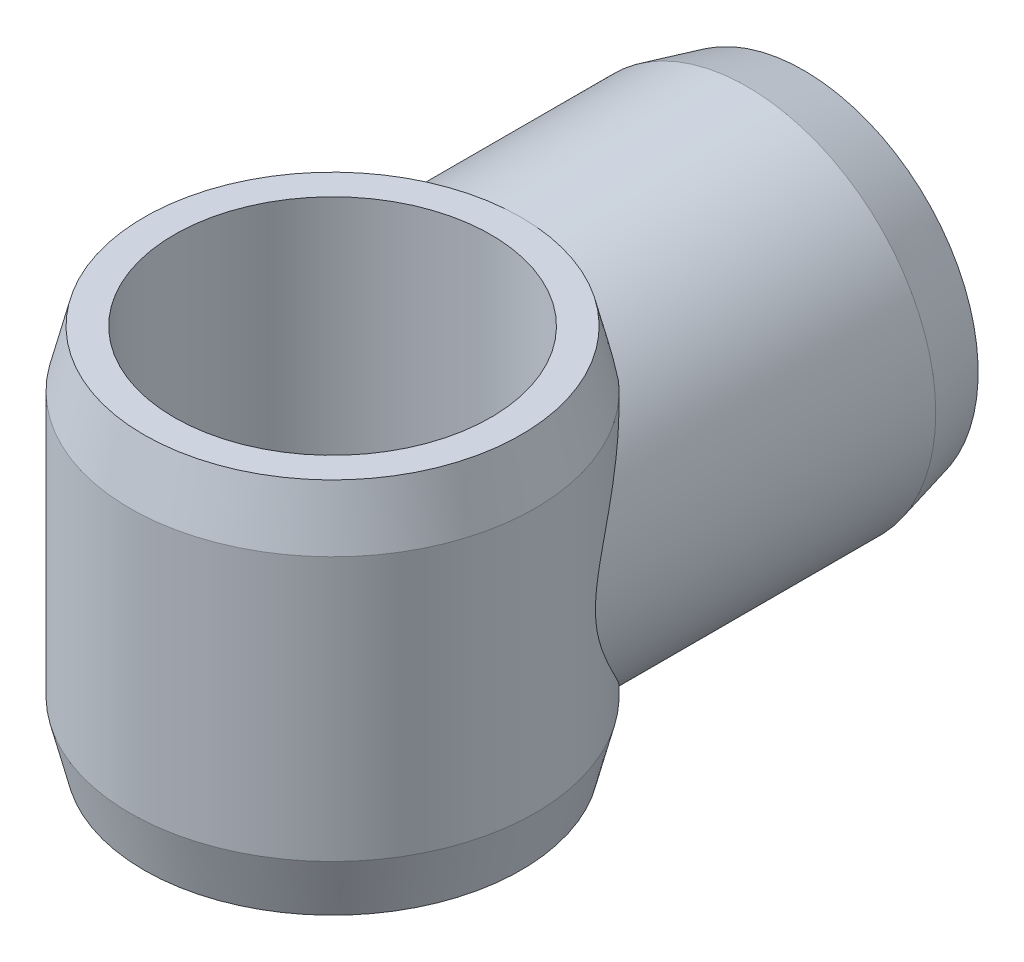
from build123d import *

# Parameters (mm, degrees)
SKETCH1_R           = 13.6525
SKETCH1_R_2         = 10.668
BOSS_EXTRUDE1_DEPTH = 25.4
BOSS_EXTRUDE2_REACH = 55.786
SKETCH4_R           = 12.7
SKETCH4_R_2         = 10.668
SKETCH12_R          = 10.668
CUT_EXTRUDE1_DEPTH  = 19.05
BOSS_EXTRUDE4_REACH = 41.064


with BuildPart() as part:
    # Sketch1 → Boss-Extrude1 (new body)
    with BuildSketch(Plane(origin=(0, 0, 0), x_dir=(1, 0, 0), z_dir=(0, 1, 0))):
        with Locations(Location((0, 0, 0), (0, 0, 270))):
            Circle(SKETCH1_R)
        with Locations(Location((0, 0, 0), (0, 0, 270))):
            Circle(SKETCH1_R_2, mode=Mode.SUBTRACT)
    extrude(amount=BOSS_EXTRUDE1_DEPTH)

    # Sketch10 → Cut-Revolve4 (revolve, cut)
    with BuildSketch(Plane(origin=(0, 0, 0), x_dir=(0, 0, -1), z_dir=(1, 0, 0)), mode=Mode.PRIVATE) as cut_revolve4_sk:
        Polygon((-13.6525, 0), (-13.6525, 3.81), (-12.7, 0), align=None)
    cut_revolve4 = revolve(cut_revolve4_sk.sketch.rotate(Axis((0, 0, 0), (0, 1, 0)), 180), axis=Axis((0, 0, 0), (0, 1, 0)), mode=Mode.SUBTRACT)

    # Mirror1: Cut-Revolve4 across plane
    add(cut_revolve4.mirror(Plane.ZX.offset(12.7)), mode=Mode.SUBTRACT)

    # Sketch4 → Boss-Extrude2 (add, up to next)
    with BuildSketch(Plane.XY.offset(-31.75), mode=Mode.PRIVATE) as boss_extrude2_sk1:
        with Locations(Location((0, 12.7, 0), (0, 0, 224.427003928))):
            Circle(SKETCH4_R)
        with Locations(Location((0, 12.7, 0), (0, 0, 236.442690207))):
            Circle(SKETCH4_R_2, mode=Mode.SUBTRACT)
    boss_extrude2_tool1 = extrude(boss_extrude2_sk1.sketch, amount=BOSS_EXTRUDE2_REACH, mode=Mode.PRIVATE) - part.part
    add(boss_extrude2_tool1.solids().sort_by_distance((8.813087, 21.338553, -31.75))[0])

    # Sketch11 → Cut-Revolve5 (revolve, cut)
    with BuildSketch(Plane(origin=(0, 0, 0), x_dir=(0, 0, -1), z_dir=(1, 0, 0)), mode=Mode.PRIVATE) as cut_revolve5_sk:
        Polygon((31.75, 0), (27.94, 0), (31.75, 0.9525), align=None)
    revolve(cut_revolve5_sk.sketch.rotate(Axis((0, 12.7, -31.75), (0, 0, 1)), 270), axis=Axis((0, 12.7, -31.75), (0, 0, 1)), mode=Mode.SUBTRACT)

    # Sketch12 → Cut-Extrude1 (cut)
    with BuildSketch(Plane(origin=(0, 0, -31.75), x_dir=(-1, 0, 0), z_dir=(0, 0, -1))):
        with Locations(Location((0, 12.7, 0), (0, 0, 303.557309793))):
            Circle(SKETCH12_R)
    extrude(amount=-CUT_EXTRUDE1_DEPTH, mode=Mode.SUBTRACT)

    # Sketch13 → Boss-Extrude4 (add, up to next)
    with BuildSketch(Plane(origin=(0, 0, -12.7), x_dir=(-1, 0, 0), z_dir=(0, 0, -1)), mode=Mode.PRIVATE) as boss_extrude4_sk1:
        with BuildLine():
            ThreePointArc((4.42238726, 2.991822265), (10.668, 12.700000001), (4.422387259, 22.408177735))
            add(Edge.make_bspline(
                [(4.422387248, 22.408177726), (4.714008579, 22.02457668), (5.010065494, 21.59)],
                knots=[0.341540519, 0.341540519, 0.341540519, 0.384917679, 0.384917679, 0.384917679], degree=2, weights=[1, 1.000235206, 1]))
            Line((5.010065494, 21.59), (5.010065494, 20.65120417))
            ThreePointArc((5.010065494, 20.65120417), (9.398, 12.7), (5.010065494, 4.74879583))
            Line((5.010065494, 4.74879583), (5.010065494, 3.81))
            add(Edge.make_bspline(
                [(5.010065496, 3.810000003), (4.714008581, 3.375423322), (4.422387248, 2.991822274)],
                knots=[-0.384917679, -0.384917679, -0.384917679, -0.341540519, -0.341540519, -0.341540519], degree=2, weights=[1, 1.000235206, 1]))
        make_face()
    boss_extrude4_tool1 = extrude(boss_extrude4_sk1.sketch, amount=-BOSS_EXTRUDE4_REACH, mode=Mode.PRIVATE) - part.part
    # Sketch13 → Boss-Extrude4 (add, up to next)
    with BuildSketch(Plane(origin=(0, 0, -12.7), x_dir=(-1, 0, 0), z_dir=(0, 0, -1)), mode=Mode.PRIVATE) as boss_extrude4_sk2:
        with BuildLine():
            add(Edge.make_bspline(
                [(-5.010065494, 21.59), (-4.714008579, 22.02457668), (-4.422387248, 22.408177726)],
                knots=[-0.384917679, -0.384917679, -0.384917679, -0.341540519, -0.341540519, -0.341540519], degree=2, weights=[1, 1.000235206, 1]))
            ThreePointArc((-4.422387259, 22.408177735), (-10.668, 12.7), (-4.422387258, 2.991822265))
            add(Edge.make_bspline(
                [(-4.422387248, 2.991822273), (-4.71400858, 3.375423321), (-5.010065496, 3.810000003)],
                knots=[0.341540519, 0.341540519, 0.341540519, 0.384917679, 0.384917679, 0.384917679], degree=2, weights=[1, 1.000235206, 1]))
            Line((-5.010065494, 3.81), (-5.010065494, 4.74879583))
            ThreePointArc((-5.010065494, 4.74879583), (-9.398, 12.7), (-5.010065494, 20.65120417))
            Line((-5.010065494, 20.65120417), (-5.010065494, 21.59))
        make_face()
    boss_extrude4_tool2 = extrude(boss_extrude4_sk2.sketch, amount=-BOSS_EXTRUDE4_REACH, mode=Mode.PRIVATE) - part.part
    add(boss_extrude4_tool1.solids().sort_by_distance((-10.464039, 12.7, -12.7))[0])
    add(boss_extrude4_tool2.solids().sort_by_distance((5.214027, 21.120602, -12.7))[0])


solid = part.part
